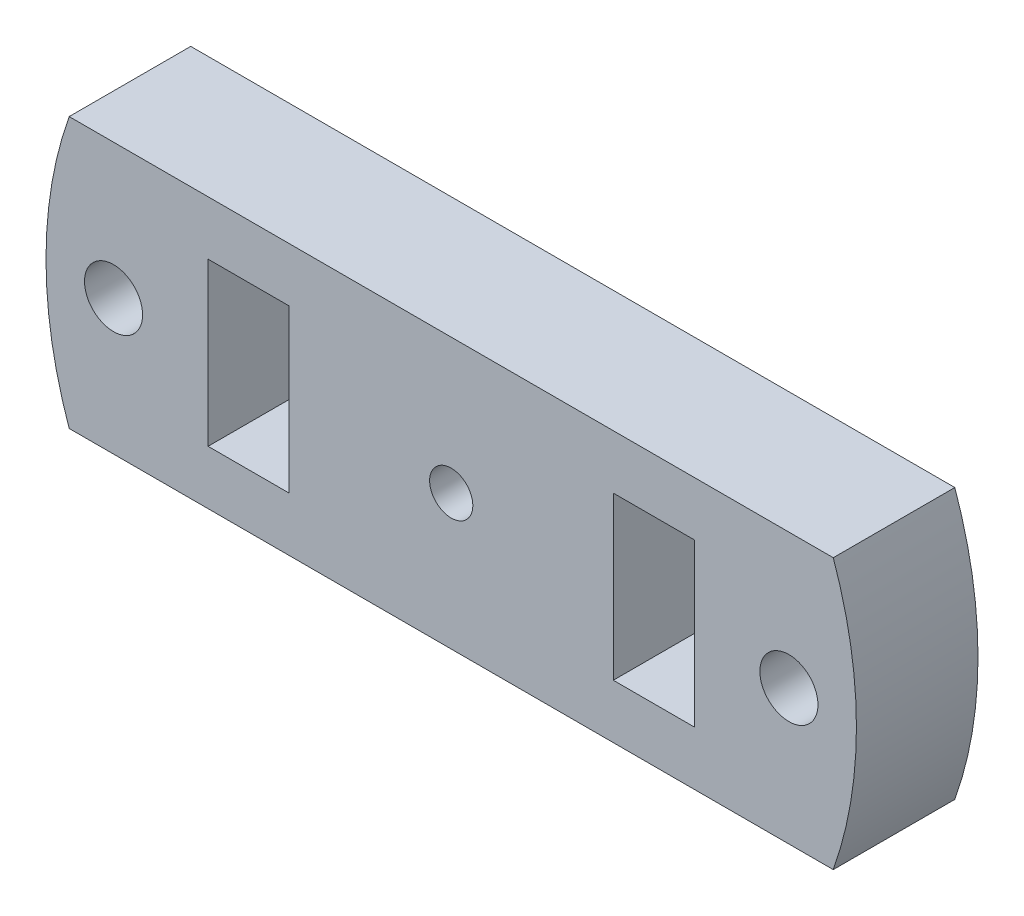
from build123d import *

# Parameters (mm, degrees)
ESQUISSE1_R             = 2.15
ESQUISSE1_W             = 6
ESQUISSE1_H             = 12
BOSS_EXTRU_1_DEPTH      = 9
ESQUISSE2_R             = 8
ENL_V_MAT_EXTRU_1_DEPTH = 5
ESQUISSE3_R             = 1.6
ENL_V_MAT_EXTRU_2_DEPTH = 33.878564446


with BuildPart() as part:
    # Esquisse1 → Boss.-Extru.1 (new body)
    with BuildSketch(Plane.XY):
        with BuildLine():
            Line((0, -10), (-28.284271247, -10))
            ThreePointArc((-28.284271247, -10), (-30, 0), (-28.284271247, 10))
            Line((-28.284271247, 10), (0, 10))
            Line((0, 10), (28.284271247, 10))
            ThreePointArc((28.284271247, 10), (30, 0), (28.284271247, -10))
            Line((28.284271247, -10), (0, -10))
        make_face()
        with Locations((-25, 0)):
            Circle(ESQUISSE1_R, mode=Mode.SUBTRACT)
        with Locations((25, 0)):
            Circle(ESQUISSE1_R, mode=Mode.SUBTRACT)
        with Locations((-15, 0)):
            Rectangle(ESQUISSE1_W, ESQUISSE1_H, mode=Mode.SUBTRACT)
        with Locations((15, 0)):
            Rectangle(ESQUISSE1_W, ESQUISSE1_H, mode=Mode.SUBTRACT)
    extrude(amount=BOSS_EXTRU_1_DEPTH)

    # Esquisse2 → Enlèv. mat.-Extru.1 (cut)
    with BuildSketch(Plane(origin=(0, 0, 0), x_dir=(-1, 0, 0), z_dir=(0, 0, -1))):
        Circle(ESQUISSE2_R)
    extrude(amount=-ENL_V_MAT_EXTRU_1_DEPTH, mode=Mode.SUBTRACT)

    # Esquisse3 → Enlèv. mat.-Extru.2 (cut, through all)
    with BuildSketch(Plane.XY.offset(9)):
        Circle(ESQUISSE3_R)
    extrude(amount=-ENL_V_MAT_EXTRU_2_DEPTH, mode=Mode.SUBTRACT)


solid = part.part
